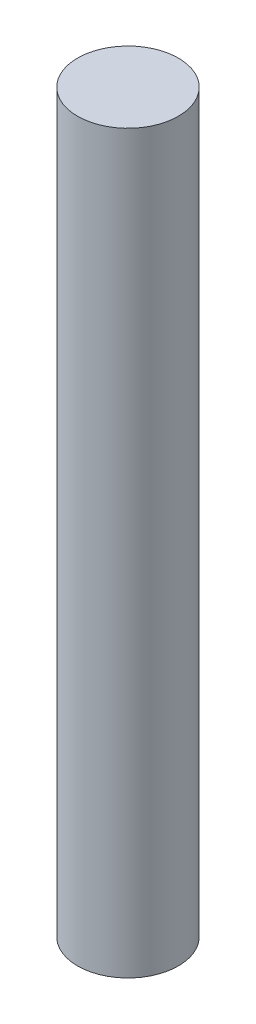
from build123d import *

# Parameters (mm, degrees)
SKETCH1_R           = 0.5
BOSS_EXTRUDE1_DEPTH = 7.3


with BuildPart() as part:
    # Sketch1 → Boss-Extrude1 (new body)
    with BuildSketch(Plane(origin=(0, 0, 0), x_dir=(1, 0, 0), z_dir=(0, 1, 0))):
        with Locations(Location((0, 0, 0), (0, 0, 270))):
            Circle(SKETCH1_R)
    extrude(amount=BOSS_EXTRUDE1_DEPTH)


solid = part.part
